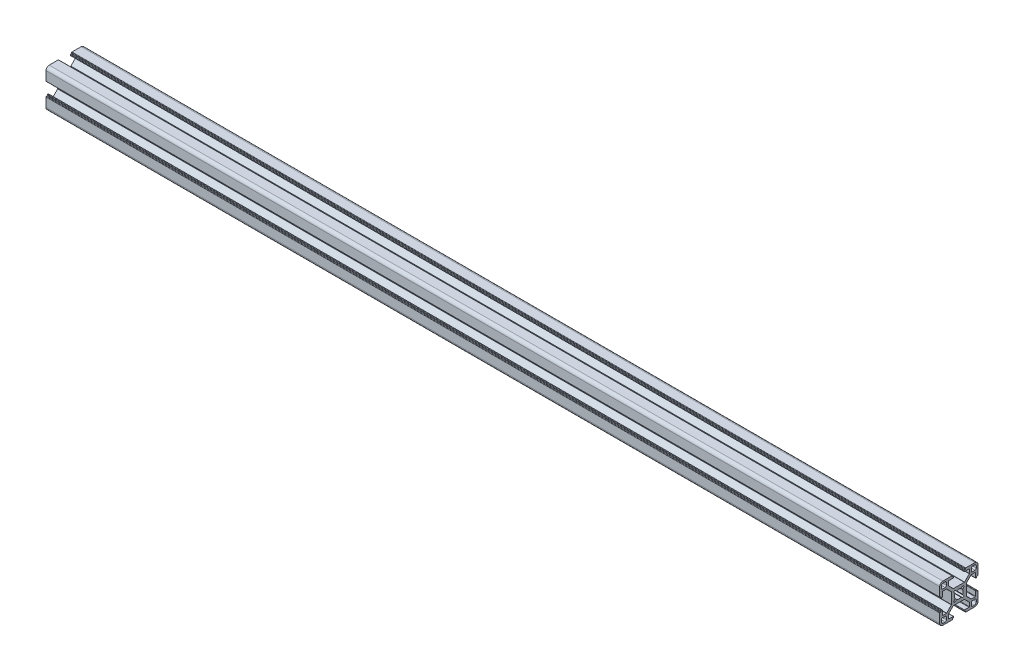
from build123d import *

# Parameters (mm, degrees)
BOSS_EXTRUDE1_DEPTH = 700


with BuildPart() as part:
    # Sketch1 → Boss-Extrude1 (new body)
    with BuildSketch(Plane(origin=(0, 0, 0), x_dir=(0, 0, -1), z_dir=(1, 0, 0))):
        with BuildLine():
            Line((-8.25, 9.788477631), (-8.25, 12.7))
            ThreePointArc((-8.25, 12.7), (-8.162132034, 12.912132034), (-7.95, 13))
            Line((-7.95, 13), (-4.4, 13))
            ThreePointArc((-4.4, 13), (-4.187867966, 13.087867966), (-4.1, 13.3))
            Line((-4.1, 13.3), (-4.1, 13.7))
            ThreePointArc((-4.1, 13.7), (-4.187867966, 13.912132034), (-4.4, 14))
            Line((-4.4, 14), (-4.8, 14))
            ThreePointArc((-4.8, 14), (-5.012132034, 14.087867966), (-5.1, 14.3))
            Line((-5.1, 14.3), (-5.1, 14.7))
            ThreePointArc((-5.1, 14.7), (-5.187867966, 14.912132034), (-5.4, 15))
            Line((-5.4, 15), (-12.5, 15))
            ThreePointArc((-12.5, 15), (-14.267766953, 14.267766953), (-15, 12.5))
            Line((-15, 12.5), (-15, 5.4))
            ThreePointArc((-15, 5.4), (-14.912132034, 5.187867966), (-14.7, 5.1))
            Line((-14.7, 5.1), (-14.3, 5.1))
            ThreePointArc((-14.3, 5.1), (-14.087867966, 5.012132034), (-14, 4.8))
            Line((-14, 4.8), (-14, 4.4))
            ThreePointArc((-14, 4.4), (-13.912132034, 4.187867966), (-13.7, 4.1))
            Line((-13.7, 4.1), (-13.3, 4.1))
            ThreePointArc((-13.3, 4.1), (-13.087867966, 4.187867966), (-13, 4.4))
            Line((-13, 4.4), (-13, 7.95))
            ThreePointArc((-13, 7.95), (-12.912132034, 8.162132034), (-12.7, 8.25))
            Line((-12.7, 8.25), (-9.788477631, 8.25))
            ThreePointArc((-9.788477631, 8.25), (-9.673672601, 8.22716386), (-9.576345597, 8.162132034))
            Line((-9.576345597, 8.162132034), (-5.887867966, 4.473654403))
            ThreePointArc((-5.887867966, 4.473654403), (-5.82283614, 4.376327399), (-5.8, 4.261522369))
            Line((-5.8, 4.261522369), (-5.8, -4.261522369))
            ThreePointArc((-5.8, -4.261522369), (-5.82283614, -4.376327399), (-5.887867966, -4.473654403))
            Line((-5.887867966, -4.473654403), (-9.576345597, -8.162132034))
            ThreePointArc((-9.576345597, -8.162132034), (-9.673672601, -8.22716386), (-9.788477631, -8.25))
            Line((-9.788477631, -8.25), (-12.7, -8.25))
            ThreePointArc((-12.7, -8.25), (-12.912132034, -8.162132034), (-13, -7.95))
            Line((-13, -7.95), (-13, -4.4))
            ThreePointArc((-13, -4.4), (-13.087867966, -4.187867966), (-13.3, -4.1))
            Line((-13.3, -4.1), (-13.7, -4.1))
            ThreePointArc((-13.7, -4.1), (-13.912132034, -4.187867966), (-14, -4.4))
            Line((-14, -4.4), (-14, -4.8))
            ThreePointArc((-14, -4.8), (-14.087867966, -5.012132034), (-14.3, -5.1))
            Line((-14.3, -5.1), (-14.7, -5.1))
            ThreePointArc((-14.7, -5.1), (-14.912132034, -5.187867966), (-15, -5.4))
            Line((-15, -5.4), (-15, -12.5))
            ThreePointArc((-15, -12.5), (-14.267766953, -14.267766953), (-12.5, -15))
            Line((-12.5, -15), (-5.4, -15))
            ThreePointArc((-5.4, -15), (-5.187867966, -14.912132034), (-5.1, -14.7))
            Line((-5.1, -14.7), (-5.1, -14.3))
            ThreePointArc((-5.1, -14.3), (-5.012132034, -14.087867966), (-4.8, -14))
            Line((-4.8, -14), (-4.4, -14))
            ThreePointArc((-4.4, -14), (-4.187867966, -13.912132034), (-4.1, -13.7))
            Line((-4.1, -13.7), (-4.1, -13.3))
            ThreePointArc((-4.1, -13.3), (-4.187867966, -13.087867966), (-4.4, -13))
            Line((-4.4, -13), (-7.95, -13))
            ThreePointArc((-7.95, -13), (-8.162132034, -12.912132034), (-8.25, -12.7))
            Line((-8.25, -12.7), (-8.25, -9.788477631))
            ThreePointArc((-8.25, -9.788477631), (-8.22716386, -9.673672601), (-8.162132034, -9.576345597))
            Line((-8.162132034, -9.576345597), (-4.473654403, -5.887867966))
            ThreePointArc((-4.473654403, -5.887867966), (-4.376327399, -5.82283614), (-4.261522369, -5.8))
            Line((-4.261522369, -5.8), (4.261522369, -5.8))
            ThreePointArc((4.261522369, -5.8), (4.376327399, -5.82283614), (4.473654403, -5.887867966))
            Line((4.473654403, -5.887867966), (8.162132034, -9.576345597))
            ThreePointArc((8.162132034, -9.576345597), (8.22716386, -9.673672601), (8.25, -9.788477631))
            Line((8.25, -9.788477631), (8.25, -12.7))
            ThreePointArc((8.25, -12.7), (8.162132034, -12.912132034), (7.95, -13))
            Line((7.95, -13), (4.4, -13))
            ThreePointArc((4.4, -13), (4.187867966, -13.087867966), (4.1, -13.3))
            Line((4.1, -13.3), (4.1, -13.7))
            ThreePointArc((4.1, -13.7), (4.187867966, -13.912132034), (4.4, -14))
            Line((4.4, -14), (4.8, -14))
            ThreePointArc((4.8, -14), (5.012132034, -14.087867966), (5.1, -14.3))
            Line((5.1, -14.3), (5.1, -14.7))
            ThreePointArc((5.1, -14.7), (5.187867966, -14.912132034), (5.4, -15))
            Line((5.4, -15), (12.5, -15))
            ThreePointArc((12.5, -15), (14.267766953, -14.267766953), (15, -12.5))
            Line((15, -12.5), (15, -5.4))
            ThreePointArc((15, -5.4), (14.912132034, -5.187867966), (14.7, -5.1))
            Line((14.7, -5.1), (14.3, -5.1))
            ThreePointArc((14.3, -5.1), (14.087867966, -5.012132034), (14, -4.8))
            Line((14, -4.8), (14, -4.4))
            ThreePointArc((14, -4.4), (13.912132034, -4.187867966), (13.7, -4.1))
            Line((13.7, -4.1), (13.3, -4.1))
            ThreePointArc((13.3, -4.1), (13.087867966, -4.187867966), (13, -4.4))
            Line((13, -4.4), (13, -7.95))
            ThreePointArc((13, -7.95), (12.912132034, -8.162132034), (12.7, -8.25))
            Line((12.7, -8.25), (9.788477631, -8.25))
            ThreePointArc((9.788477631, -8.25), (9.673672601, -8.22716386), (9.576345597, -8.162132034))
            Line((9.576345597, -8.162132034), (5.887867966, -4.473654403))
            ThreePointArc((5.887867966, -4.473654403), (5.82283614, -4.376327399), (5.8, -4.261522369))
            Line((5.8, -4.261522369), (5.8, 4.261522369))
            ThreePointArc((5.8, 4.261522369), (5.82283614, 4.376327399), (5.887867966, 4.473654403))
            Line((5.887867966, 4.473654403), (9.576345597, 8.162132034))
            ThreePointArc((9.576345597, 8.162132034), (9.673672601, 8.22716386), (9.788477631, 8.25))
            Line((9.788477631, 8.25), (12.7, 8.25))
            ThreePointArc((12.7, 8.25), (12.912132034, 8.162132034), (13, 7.95))
            Line((13, 7.95), (13, 4.4))
            ThreePointArc((13, 4.4), (13.087867966, 4.187867966), (13.3, 4.1))
            Line((13.3, 4.1), (13.7, 4.1))
            ThreePointArc((13.7, 4.1), (13.912132034, 4.187867966), (14, 4.4))
            Line((14, 4.4), (14, 4.8))
            ThreePointArc((14, 4.8), (14.087867966, 5.012132034), (14.3, 5.1))
            Line((14.3, 5.1), (14.7, 5.1))
            ThreePointArc((14.7, 5.1), (14.912132034, 5.187867966), (15, 5.4))
            Line((15, 5.4), (15, 12.5))
            ThreePointArc((15, 12.5), (14.267766953, 14.267766953), (12.5, 15))
            Line((12.5, 15), (5.4, 15))
            ThreePointArc((5.4, 15), (5.187867966, 14.912132034), (5.1, 14.7))
            Line((5.1, 14.7), (5.1, 14.3))
            ThreePointArc((5.1, 14.3), (5.012132034, 14.087867966), (4.8, 14))
            Line((4.8, 14), (4.4, 14))
            ThreePointArc((4.4, 14), (4.187867966, 13.912132034), (4.1, 13.7))
            Line((4.1, 13.7), (4.1, 13.3))
            ThreePointArc((4.1, 13.3), (4.187867966, 13.087867966), (4.4, 13))
            Line((4.4, 13), (7.95, 13))
            ThreePointArc((7.95, 13), (8.162132034, 12.912132034), (8.25, 12.7))
            Line((8.25, 12.7), (8.25, 9.788477631))
            ThreePointArc((8.25, 9.788477631), (8.22716386, 9.673672601), (8.162132034, 9.576345597))
            Line((8.162132034, 9.576345597), (4.473654403, 5.887867966))
            ThreePointArc((4.473654403, 5.887867966), (4.376327399, 5.82283614), (4.261522369, 5.8))
            Line((4.261522369, 5.8), (-4.261522369, 5.8))
            ThreePointArc((-4.261522369, 5.8), (-4.376327399, 5.82283614), (-4.473654403, 5.887867966))
            Line((-4.473654403, 5.887867966), (-8.162132034, 9.576345597))
            ThreePointArc((-8.162132034, 9.576345597), (-8.22716386, 9.673672601), (-8.25, 9.788477631))
        make_face()
        with BuildLine():
            Line((3.05514787, -1.904659815), (3.741964502, -2.698343541))
            ThreePointArc((3.741964502, -2.698343541), (3.70396732, -3.720635173), (2.68151539, -3.75404201))
            Line((2.68151539, -3.75404201), (1.890923385, -3.06366876))
            ThreePointArc((1.890923385, -3.06366876), (1.729867527, -2.991839768), (1.556279141, -3.022911715))
            ThreePointArc((1.556279141, -3.022911715), (0, -3.4), (-1.55627914, -3.022911715))
            ThreePointArc((-1.55627914, -3.022911715), (-1.729867526, -2.991839768), (-1.890923385, -3.06366876))
            Line((-1.890923385, -3.06366876), (-2.68151539, -3.75404201))
            ThreePointArc((-2.68151539, -3.75404201), (-3.70396732, -3.720635173), (-3.741964502, -2.698343541))
            Line((-3.741964502, -2.698343541), (-3.05514787, -1.904659815))
            ThreePointArc((-3.05514787, -1.904659815), (-2.984042722, -1.743283077), (-3.015893746, -1.56983595))
            ThreePointArc((-3.015893746, -1.56983595), (-3.4, 0), (-3.015893746, 1.56983595))
            ThreePointArc((-3.015893746, 1.56983595), (-2.984042722, 1.743283077), (-3.05514787, 1.904659815))
            Line((-3.05514787, 1.904659815), (-3.741964502, 2.698343541))
            ThreePointArc((-3.741964502, 2.698343541), (-3.70396732, 3.720635173), (-2.68151539, 3.75404201))
            Line((-2.68151539, 3.75404201), (-1.890923385, 3.06366876))
            ThreePointArc((-1.890923385, 3.06366876), (-1.729867526, 2.991839768), (-1.55627914, 3.022911715))
            ThreePointArc((-1.55627914, 3.022911715), (0, 3.4), (1.556279141, 3.022911715))
            ThreePointArc((1.556279141, 3.022911715), (1.729867527, 2.991839768), (1.890923385, 3.06366876))
            Line((1.890923385, 3.06366876), (2.68151539, 3.75404201))
            ThreePointArc((2.68151539, 3.75404201), (3.70396732, 3.720635173), (3.741964502, 2.698343541))
            Line((3.741964502, 2.698343541), (3.05514787, 1.904659815))
            ThreePointArc((3.05514787, 1.904659815), (2.984042722, 1.743283077), (3.015893747, 1.56983595))
            ThreePointArc((3.015893747, 1.56983595), (3.4, 0), (3.015893747, -1.56983595))
            ThreePointArc((3.015893747, -1.56983595), (2.984042722, -1.743283077), (3.05514787, -1.904659815))
        make_face(mode=Mode.SUBTRACT)
        with BuildLine():
            Line((10.75, -9.75), (12.65, -9.75))
            ThreePointArc((12.65, -9.75), (13.357106781, -10.042893219), (13.65, -10.75))
            Line((13.65, -10.75), (13.65, -12.15))
            ThreePointArc((13.65, -12.15), (13.210660172, -13.210660172), (12.15, -13.65))
            Line((12.15, -13.65), (10.75, -13.65))
            ThreePointArc((10.75, -13.65), (10.042893219, -13.357106781), (9.75, -12.65))
            Line((9.75, -12.65), (9.75, -10.75))
            ThreePointArc((9.75, -10.75), (10.042893219, -10.042893219), (10.75, -9.75))
        make_face(mode=Mode.SUBTRACT)
        with BuildLine():
            Line((-10.75, 9.75), (-12.65, 9.75))
            ThreePointArc((-12.65, 9.75), (-13.357106781, 10.042893219), (-13.65, 10.75))
            Line((-13.65, 10.75), (-13.65, 12.15))
            ThreePointArc((-13.65, 12.15), (-13.210660172, 13.210660172), (-12.15, 13.65))
            Line((-12.15, 13.65), (-10.75, 13.65))
            ThreePointArc((-10.75, 13.65), (-10.042893219, 13.357106781), (-9.75, 12.65))
            Line((-9.75, 12.65), (-9.75, 10.75))
            ThreePointArc((-9.75, 10.75), (-10.042893219, 10.042893219), (-10.75, 9.75))
        make_face(mode=Mode.SUBTRACT)
        with BuildLine():
            Line((9.75, 10.75), (9.75, 12.65))
            ThreePointArc((9.75, 12.65), (10.042893219, 13.357106781), (10.75, 13.65))
            Line((10.75, 13.65), (12.15, 13.65))
            ThreePointArc((12.15, 13.65), (13.210660172, 13.210660172), (13.65, 12.15))
            Line((13.65, 12.15), (13.65, 10.75))
            ThreePointArc((13.65, 10.75), (13.357106781, 10.042893219), (12.65, 9.75))
            Line((12.65, 9.75), (10.75, 9.75))
            ThreePointArc((10.75, 9.75), (10.042893219, 10.042893219), (9.75, 10.75))
        make_face(mode=Mode.SUBTRACT)
        with BuildLine():
            Line((-9.75, -10.75), (-9.75, -12.65))
            ThreePointArc((-9.75, -12.65), (-10.042893219, -13.357106781), (-10.75, -13.65))
            Line((-10.75, -13.65), (-12.15, -13.65))
            ThreePointArc((-12.15, -13.65), (-13.210660172, -13.210660172), (-13.65, -12.15))
            Line((-13.65, -12.15), (-13.65, -10.75))
            ThreePointArc((-13.65, -10.75), (-13.357106781, -10.042893219), (-12.65, -9.75))
            Line((-12.65, -9.75), (-10.75, -9.75))
            ThreePointArc((-10.75, -9.75), (-10.042893219, -10.042893219), (-9.75, -10.75))
        make_face(mode=Mode.SUBTRACT)
    extrude(amount=BOSS_EXTRUDE1_DEPTH)


solid = part.part
